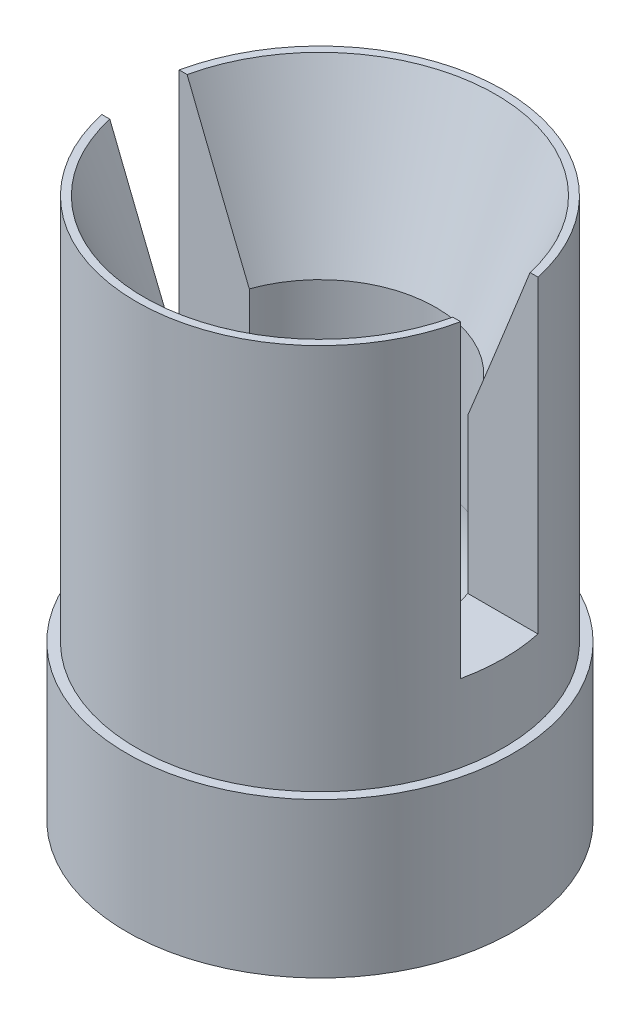
from build123d import *

# Parameters (mm, degrees)
ENL_V_MAT_EXTRU_1_REACH             = 17.684
ESQUISSE2_W                         = 2
ESQUISSE2_H                         = 8
ENL_V_MAT_EXTRU_1_DIRECTION_2_REACH = 17.684


with BuildPart() as part:
    # Esquisse1 → Révolution1 (revolve)
    with BuildSketch(Plane.XY, mode=Mode.PRIVATE) as r_volution1_sk:
        with BuildLine():
            Line((0, 0), (-5, 0))
            Line((-5, 0), (-5, 4))
            Line((-5, 4), (-4.75, 4))
            Line((-4.75, 4), (-4.75, 14))
            Line((-4.75, 14), (-4.55, 14))
            Line((-4.55, 14), (-3, 10))
            Line((-3, 10), (-3, 6))
            ThreePointArc((-3, 6), (-2.121320344, 3.878679656), (0, 3))
            Line((0, 3), (0, 0))
        make_face()
    revolve(r_volution1_sk.sketch.rotate(Axis((0, -3.503417728, 0), (0, 1, 0)), 270), axis=Axis((0, -3.503417728, 0), (0, 1, 0)))

    # Esquisse2 → Enlèv. mat.-Extru.1 (cut, up to next)
    with BuildSketch(Plane(origin=(0, 0, 0), x_dir=(0, 0, -1), z_dir=(1, 0, 0)), mode=Mode.PRIVATE) as enl_v_mat_extru_1_sk1:
        with Locations((0, 10)):
            Rectangle(ESQUISSE2_W, ESQUISSE2_H)
    enl_v_mat_extru_1_tool1 = extrude(enl_v_mat_extru_1_sk1.sketch, amount=-ENL_V_MAT_EXTRU_1_REACH, mode=Mode.PRIVATE) & part.part
    add(enl_v_mat_extru_1_tool1.solids().sort_by_distance((0, 10, 0))[0], mode=Mode.SUBTRACT)

    # Esquisse2 → Enlèv. mat.-Extru.1 direction 2 (cut, up to next)
    with BuildSketch(Plane(origin=(0, 0, 0), x_dir=(0, 0, -1), z_dir=(1, 0, 0)), mode=Mode.PRIVATE) as enl_v_mat_extru_1_direction_2_sk1:
        with Locations((0, 10)):
            Rectangle(ESQUISSE2_W, ESQUISSE2_H)
    enl_v_mat_extru_1_direction_2_tool1 = extrude(enl_v_mat_extru_1_direction_2_sk1.sketch, amount=ENL_V_MAT_EXTRU_1_DIRECTION_2_REACH, mode=Mode.PRIVATE) & part.part
    add(enl_v_mat_extru_1_direction_2_tool1.solids().sort_by_distance((0, 10, 0))[0], mode=Mode.SUBTRACT)


solid = part.part
